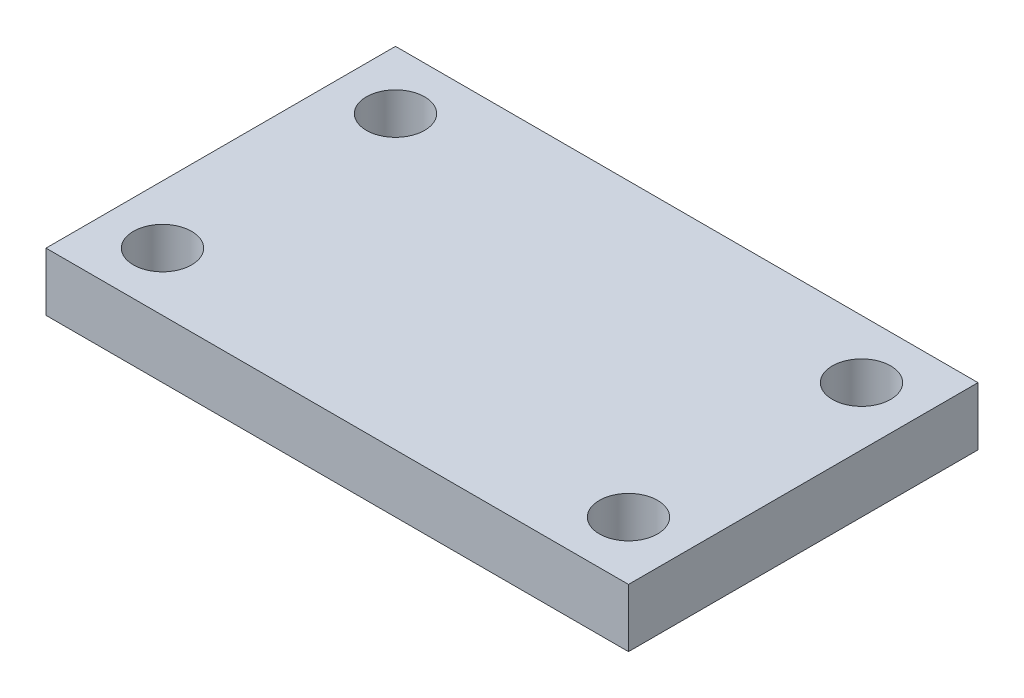
from build123d import *

# Parameters (mm, degrees)
SKETCH1_W           = 254
SKETCH1_H           = 152.4
SKETCH1_R           = 12.7
BOSS_EXTRUDE1_DEPTH = 25.4


with BuildPart() as part:
    # Sketch1 → Boss-Extrude1 (new body)
    with BuildSketch(Plane(origin=(0, 0, 0), x_dir=(1, 0, 0), z_dir=(0, 1, 0))):
        Rectangle(SKETCH1_W, SKETCH1_H)
        with Locations(Location((-101.6, 50.8, 0), (0, 0, 270))):
            Circle(SKETCH1_R, mode=Mode.SUBTRACT)
        with Locations(Location((101.6, 50.8, 0), (0, 0, 270))):
            Circle(SKETCH1_R, mode=Mode.SUBTRACT)
        with Locations(Location((-101.6, -50.8, 0), (0, 0, 270))):
            Circle(SKETCH1_R, mode=Mode.SUBTRACT)
        with Locations(Location((101.6, -50.8, 0), (0, 0, 270))):
            Circle(SKETCH1_R, mode=Mode.SUBTRACT)
    extrude(amount=BOSS_EXTRUDE1_DEPTH)


solid = part.part
